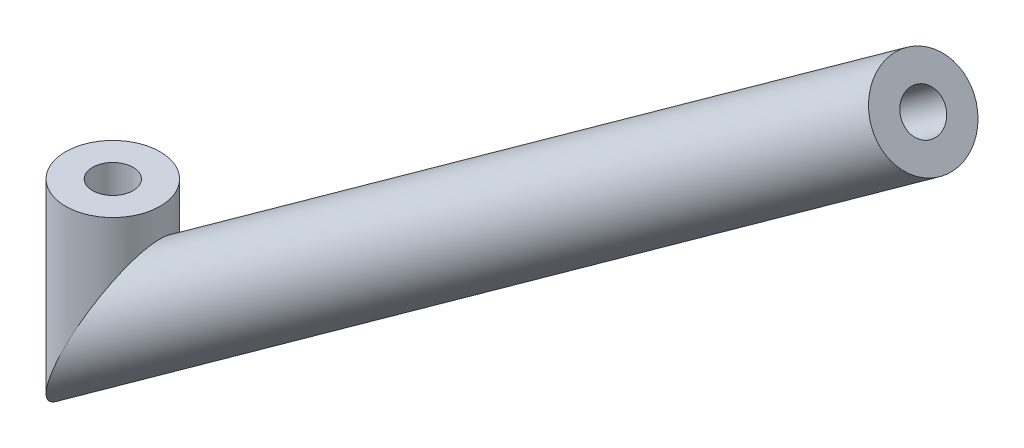
from build123d import *

# Parameters (mm, degrees)
SWEEP_THIN1_PROFILE_R   = 3.5
SWEEP_THIN1_PROFILE_R_2 = 1.5


with BuildPart() as part:
    # Sweep-Thin1: sweep along a path in Sketch7
    with BuildLine(Plane.XY) as sweep_thin1_path:
        Line((60.201976259, 54.306663616), (0.179079417, 11.072678178))
        Line((0.179079417, 11.072678178), (0.179079417, 20))
    # Sweep-Thin1 profile (on start of the path) → Sweep-Thin1 (sweep)
    with BuildSketch(Plane(origin=(60.201976259, 54.306663616, 0), x_dir=(0.5844605176520309, -0.8114221486414579, 0), z_dir=(-0.8114221486414579, -0.5844605176520309, 0))):
        Circle(SWEEP_THIN1_PROFILE_R)
        Circle(SWEEP_THIN1_PROFILE_R_2, mode=Mode.SUBTRACT)
    sweep(path=sweep_thin1_path.line, transition=Transition.RIGHT)


solid = part.part
